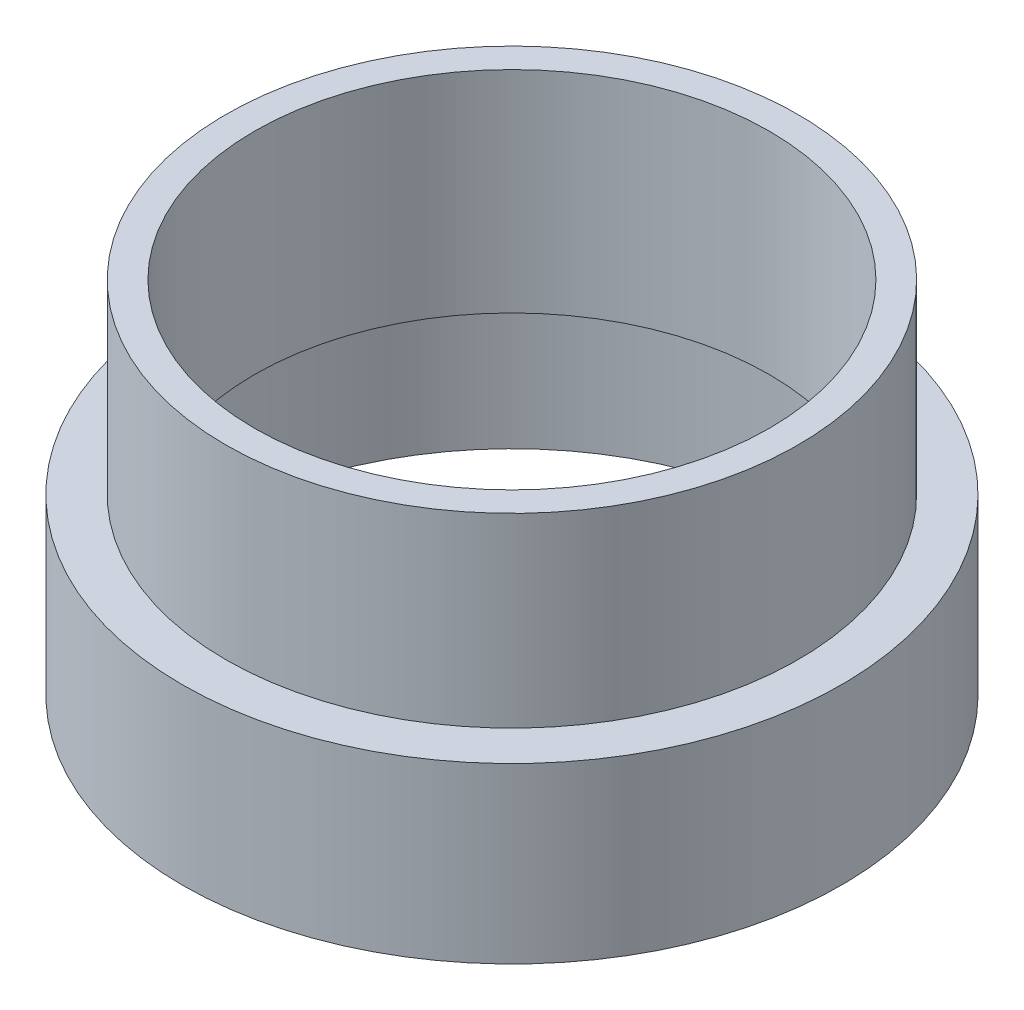
from build123d import *

# Parameters (mm, degrees)
SKETCH1_R           = 13.29
BOSS_EXTRUDE1_DEPTH = 7
SKETCH2_R           = 11.54
BOSS_EXTRUDE2_DEPTH = 7.5
SKETCH3_R           = 12.16
CUT_EXTRUDE2_DEPTH  = 6
SKETCH4_R           = 10.38
CUT_EXTRUDE4_DEPTH  = 9


with BuildPart() as part:
    # Sketch1 → Boss-Extrude1 (new body)
    with BuildSketch(Plane(origin=(0, 0, 0), x_dir=(1, 0, 0), z_dir=(0, 1, 0))):
        with Locations(Location((0, 0, 0), (0, 0, 270))):
            Circle(SKETCH1_R)
    extrude(amount=BOSS_EXTRUDE1_DEPTH)

    # Sketch2 → Boss-Extrude2 (add)
    with BuildSketch(Plane(origin=(0, 7, 0), x_dir=(1, 0, 0), z_dir=(0, 1, 0))):
        with Locations(Location((0, 0, 0), (0, 0, 270))):
            Circle(SKETCH2_R)
    extrude(amount=BOSS_EXTRUDE2_DEPTH)

    # Sketch3 → Cut-Extrude2 (cut)
    with BuildSketch(Plane(origin=(0, 0, 0), x_dir=(-1, 0, 0), z_dir=(0, -1, 0))):
        with Locations(Location((0, 0, 0), (0, 0, 90))):
            Circle(SKETCH3_R)
    extrude(amount=-CUT_EXTRUDE2_DEPTH, mode=Mode.SUBTRACT)

    # Sketch4 → Cut-Extrude4 (cut)
    with BuildSketch(Plane(origin=(0, 14.5, 0), x_dir=(1, 0, 0), z_dir=(0, 1, 0))):
        with Locations(Location((0, 0, 0), (0, 0, 270))):
            Circle(SKETCH4_R)
    extrude(amount=-CUT_EXTRUDE4_DEPTH, mode=Mode.SUBTRACT)


solid = part.part
